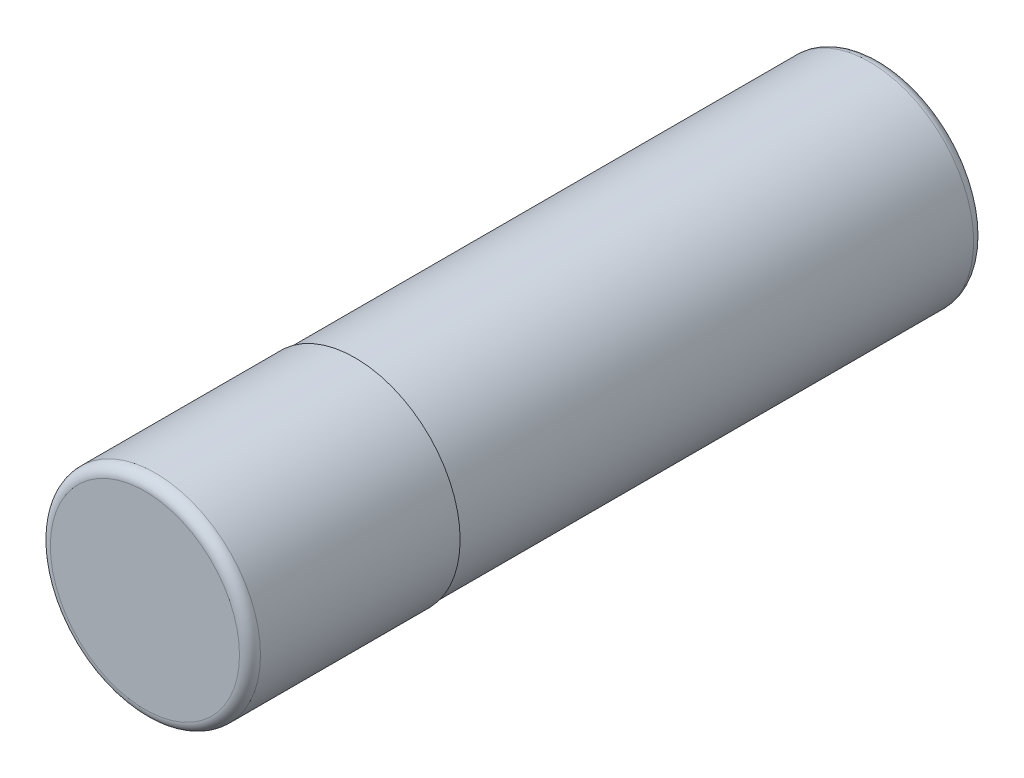
from build123d import *

# Parameters (mm, degrees)
SKETCH_1_R      = 1.975
EXTRUDE_1_DEPTH = 10
FILLET_1_R      = 0.2
SKETCH_2_R      = 2
EXTRUDE_2_DEPTH = 4
FILLET_2_R      = 0.2


with BuildPart() as part:
    # 스케치1 → 보스-돌출1 (new body)
    with BuildSketch(Plane.XY):
        Circle(SKETCH_1_R)
    extrude(amount=EXTRUDE_1_DEPTH)

    # 필렛1
    fillet_1_edges = [part.edges().sort_by_distance(p)[0] for p in [
        (-1.975, 0, 0),
    ]]
    fillet(fillet_1_edges, radius=FILLET_1_R)

    # 스케치2 → 보스-돌출2 (add)
    with BuildSketch(Plane.XY.offset(10)):
        Circle(SKETCH_2_R)
    extrude(amount=EXTRUDE_2_DEPTH)

    # 필렛2
    fillet_2_edges = [part.edges().sort_by_distance(p)[0] for p in [
        (-2, 0, 14),
    ]]
    fillet(fillet_2_edges, radius=FILLET_2_R)


solid = part.part
